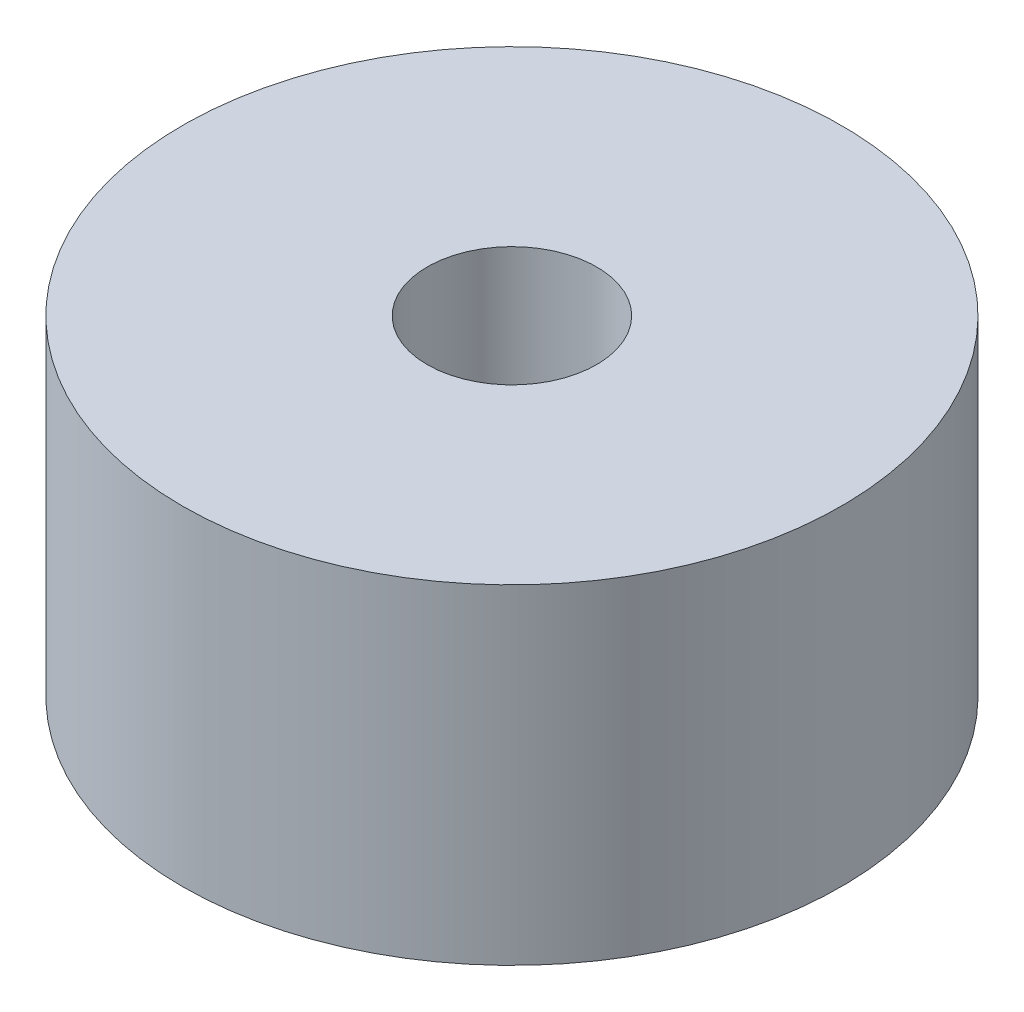
from build123d import *

# Parameters (mm, degrees)
SKETCH1_R               = 12.7
BOSS_EXTRUDE1_DEPTH     = 12.7
F_1_4_CLEARANCE_HOLE1_D = 6.5278


with BuildPart() as part:
    # Sketch1 → Boss-Extrude1 (new body)
    with BuildSketch(Plane(origin=(0, 0, 0), x_dir=(1, 0, 0), z_dir=(0, 1, 0))):
        with Locations(Location((0, 0, 0), (0, 0, 270))):
            Circle(SKETCH1_R)
    extrude(amount=BOSS_EXTRUDE1_DEPTH)

    # 1/4 Clearance Hole1 (through all)
    with Locations(Plane(origin=(0, 12.7, 0), x_dir=(1, 0, 0), z_dir=(0, 1, 0))):
        with Locations((0, 0)):
            Hole(F_1_4_CLEARANCE_HOLE1_D / 2)


solid = part.part
